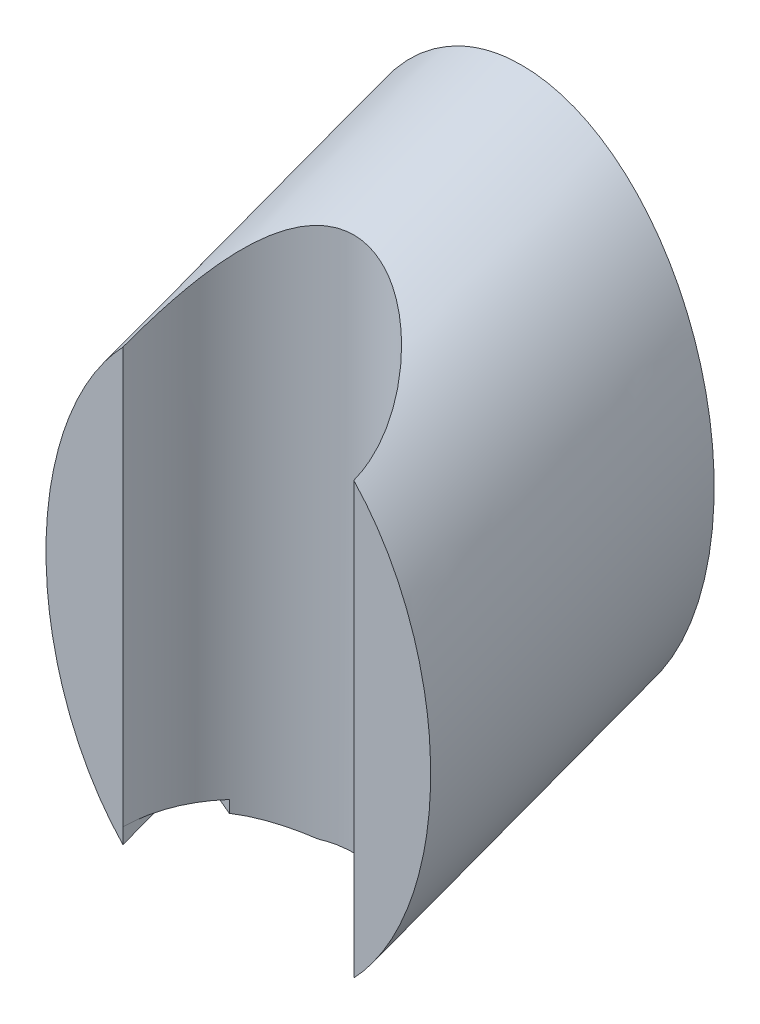
from build123d import *

# Parameters (mm, degrees)
CUT_EXTRUDE1_DEPTH      = 2.374772876
CUT_EXTRUDE1_DEPTH_BACK = 2.374772876
SKETCH6_W               = 0.6
SKETCH6_H               = 0.04
CUT_EXTRUDE2_DEPTH      = 0.2


with BuildPart() as part:
    # Sweep1: sweep along a path in Sketch3
    with BuildLine(Plane(origin=(0, 0, 0), x_dir=(0, 0, -1), z_dir=(1, 0, 0))) as sweep1_path:
        Line((0, 0), (0.8, 0.3))
    # Sketch1 → Sweep1 (sweep)
    with BuildSketch(Plane.XY):
        with BuildLine():
            Line((-0.081490966, -0.690640338), (0.081490966, -0.690640338))
            add(Edge.make_bspline(
                [(0.081490966, -0.690640338), (0.837464392, -0.515808659), (0.418732196, 0.382544327), (0, 1.280897313), (-0.418732196, 0.382544327), (-0.837464392, -0.515808659), (-0.081490966, -0.690640338)],
                knots=[3.305304901, 3.305304901, 3.305304901, 5.290558505, 5.290558505, 7.275812109, 7.275812109, 9.261065714, 9.261065714, 9.261065714], degree=2, weights=[1, 0.546491895, 1, 0.546491895, 1, 0.546491895, 1]))
        make_face()
    sweep(path=sweep1_path.line)

    # Sketch5 → Cut-Extrude1 (cut, two sides: drawn at the far end of the back side and taken through both)
    with BuildSketch(Plane(origin=(0, 0, 0), x_dir=(1, 0, 0), z_dir=(0, 1, 0)).offset(-CUT_EXTRUDE1_DEPTH_BACK)):
        with BuildLine():
            Line((-0.5, 0.063330757), (-0.300000002, 0.063330757))
            ThreePointArc((-0.300000002, 0.063330757), (-2e-09, 0.363330757), (0.299999998, 0.063330757))
            Line((0.299999998, 0.063330757), (0.5, 0.063330757))
            Line((0.5, 0.063330757), (0.5, 0))
            Line((0.5, 0), (-0.5, 0))
            Line((-0.5, 0), (-0.5, 0.063330757))
        make_face()
    extrude(amount=CUT_EXTRUDE1_DEPTH + CUT_EXTRUDE1_DEPTH_BACK, mode=Mode.SUBTRACT)

    # Sketch6 → Cut-Extrude2 (cut)
    with BuildSketch(Plane.XY.offset(-0.063330757)):
        with Locations((-2e-09, -0.516250964)):
            Rectangle(SKETCH6_W, SKETCH6_H)
    extrude(amount=-CUT_EXTRUDE2_DEPTH, mode=Mode.SUBTRACT)


solid = part.part
